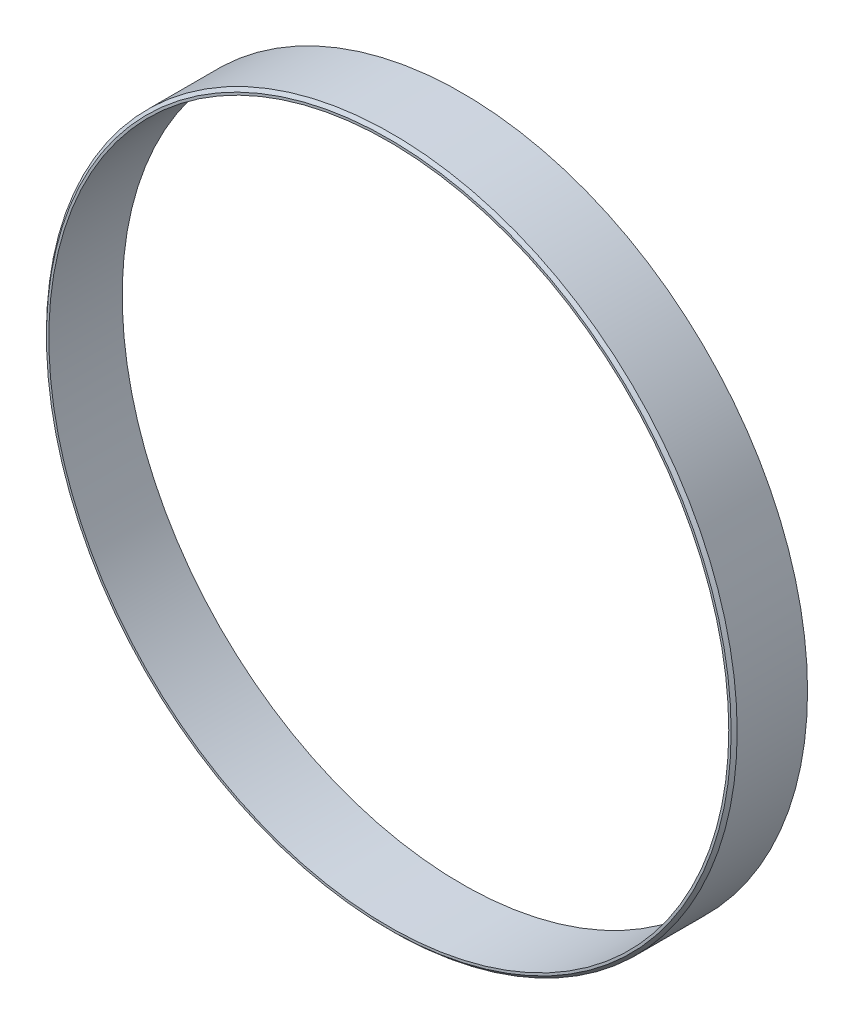
from build123d import *

# Parameters (mm, degrees)
SCHIZZO1_R                   = 80
SCHIZZO1_R_2                 = 78.75
ESTRUSIONE_ESTRUSIONE1_DEPTH = 17
SMUSSO1_SIZE                 = 0.7


with BuildPart() as part:
    # Schizzo1 → Estrusione-Estrusione1 (new body)
    with BuildSketch(Plane.XY):
        Circle(SCHIZZO1_R)
        Circle(SCHIZZO1_R_2, mode=Mode.SUBTRACT)
    extrude(amount=ESTRUSIONE_ESTRUSIONE1_DEPTH)

    # Smusso1
    smusso1_edges = [part.edges().sort_by_distance(p)[0] for p in [
        (-80, 0, 17),
    ]]
    chamfer(smusso1_edges, length=SMUSSO1_SIZE)


solid = part.part
